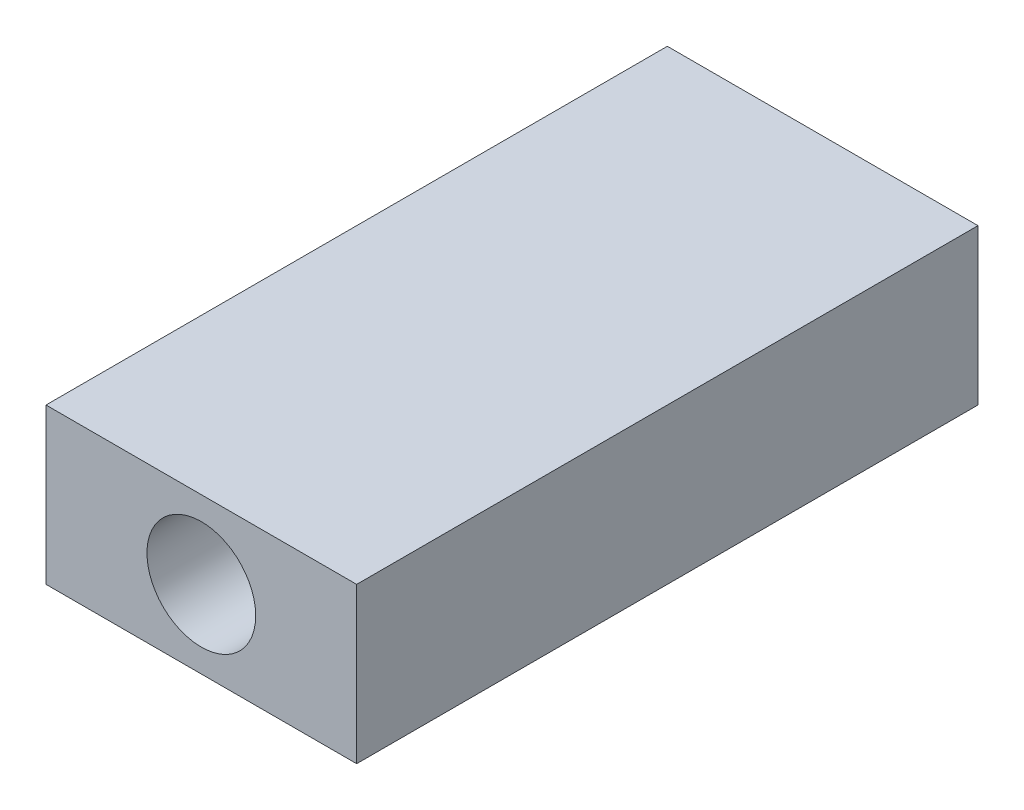
from build123d import *

# Parameters (mm, degrees)
SKETCH1_W           = 20
SKETCH1_H           = 10
SKETCH1_R           = 3.5
BOSS_EXTRUDE1_DEPTH = 40


with BuildPart() as part:
    # Sketch1 → Boss-Extrude1 (new body)
    with BuildSketch(Plane.XY):
        with Locations((0, 22.025)):
            Rectangle(SKETCH1_W, SKETCH1_H)
        with Locations((0, 22.025)):
            Circle(SKETCH1_R, mode=Mode.SUBTRACT)
    extrude(amount=BOSS_EXTRUDE1_DEPTH)


solid = part.part
